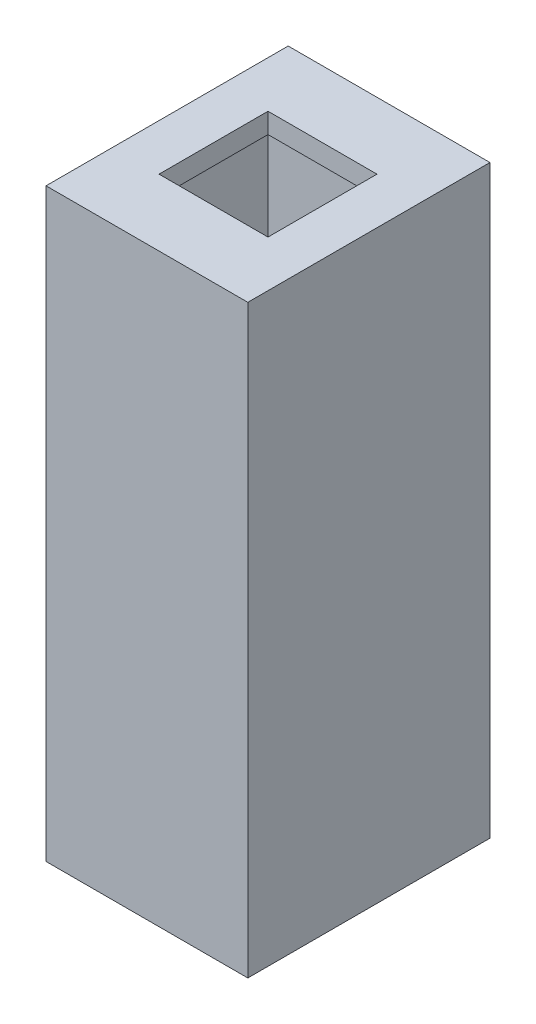
from build123d import *

# Parameters (mm, degrees)
SKETCH_1_W          = 10
SKETCH_1_H          = 12
SKETCH_1_W_2        = 6.2
SKETCH_1_H_2        = 6.2
EXTRUDE_1_DEPTH     = 29
EXTRUDE_START       = 29
SKETCH_1_3_W        = 10
SKETCH_1_3_H        = 12
SKETCH_1_3_W_2      = 6.2
SKETCH_1_3_H_2      = 6.2
SKETCH_1_3_W_3      = 5.4
SKETCH_1_3_H_3      = 5.4
EXTRUDE_2_DEPTH     = 1
SKETCH_2_R          = 0.3
CUT_EXTRUDE_1_DEPTH = 2


with BuildPart() as part:
    # 草图1 → 凸台-拉伸1 (new body)
    with BuildSketch(Plane(origin=(0, 0, 0), x_dir=(1, 0, 0), z_dir=(0, 1, 0))):
        Rectangle(SKETCH_1_W, SKETCH_1_H)
        Rectangle(SKETCH_1_W_2, SKETCH_1_H_2, mode=Mode.SUBTRACT)
    extrude(amount=EXTRUDE_1_DEPTH)

    # 草图1<3> → 凸台-拉伸2 (add)
    # profile 1 of 2: a face of its own
    with BuildSketch(Plane(origin=(0, 0, 0), x_dir=(1, 0, 0), z_dir=(0, 1, 0)).offset(EXTRUDE_START)):
        Rectangle(SKETCH_1_3_W, SKETCH_1_3_H)
        Rectangle(SKETCH_1_3_W_2, SKETCH_1_3_H_2, mode=Mode.SUBTRACT)
    # profile 2 of 2: a face of its own
    with BuildSketch(Plane(origin=(0, 0, 0), x_dir=(1, 0, 0), z_dir=(0, 1, 0)).offset(EXTRUDE_START)):
        Rectangle(SKETCH_1_3_W_2, SKETCH_1_3_H_2)
        Rectangle(SKETCH_1_3_W_3, SKETCH_1_3_H_3, mode=Mode.SUBTRACT)
    extrude(amount=-EXTRUDE_2_DEPTH)

    # 草图2 → 切除-拉伸1 (cut)
    with BuildSketch(Plane.XZ):
        with Locations(Location((-3.75, 4.5, 0), (0, 0, 270))):
            Circle(SKETCH_2_R)
        with Locations(Location((3.75, -4.5, 0), (0, 0, 270))):
            Circle(SKETCH_2_R)
        with Locations(Location((3.75, 4.5, 0), (0, 0, 270))):
            Circle(SKETCH_2_R)
        with Locations(Location((-3.75, -4.5, 0), (0, 0, 270))):
            Circle(SKETCH_2_R)
    extrude(amount=-CUT_EXTRUDE_1_DEPTH, mode=Mode.SUBTRACT)


solid = part.part
